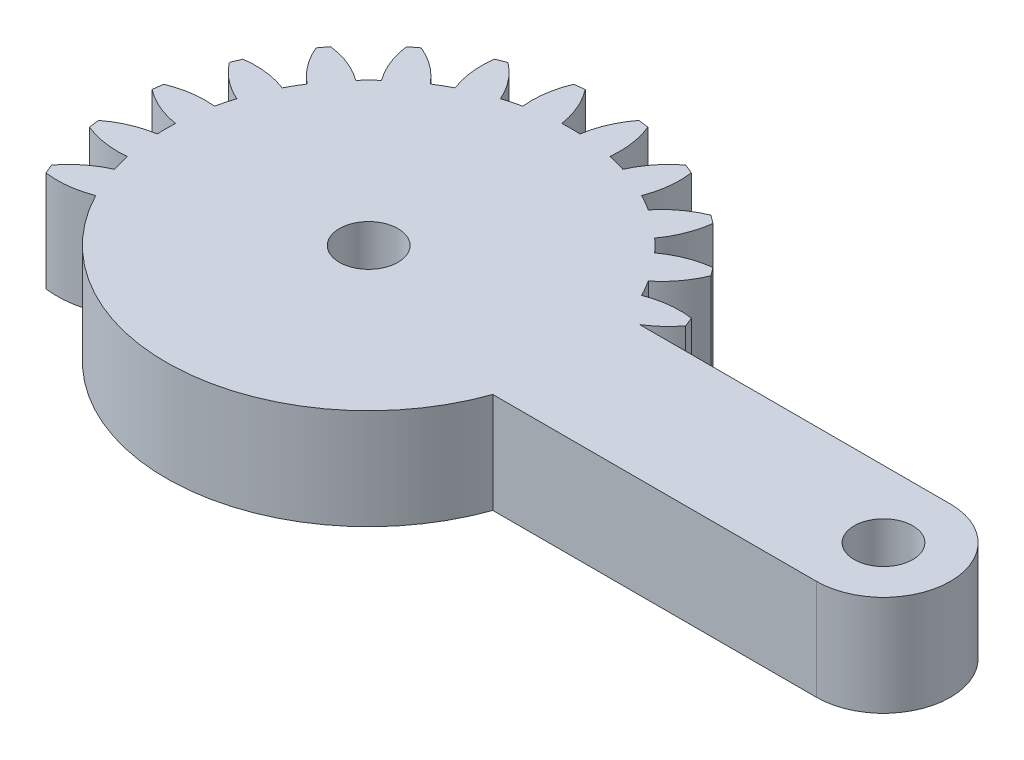
from build123d import *
from build123d.topology import SkipClean

# Parameters (mm, degrees)
SKETCH1_R           = 1.75
BOSS_EXTRUDE1_DEPTH = 4
CUT_EXTRUDE1_START  = -10
CUT_EXTRUDE1_DEPTH  = 10
MOVE_FACE1_BY       = 2


with BuildPart() as part:
    # Sketch1 → Boss-Extrude1 (new body)
    with BuildSketch(Plane(origin=(0, 0, 0), x_dir=(1, 0, 0), z_dir=(0, 1, 0))):
        with BuildLine():
            Line((20.643657446, 4), (2.081641936, 4))
            ThreePointArc((2.081641936, 4), (2.861028333, 4.588201733), (3.521749436, 5.30713988))
            ThreePointArc((3.521749436, 5.30713988), (3.405395609, 5.596745198), (3.282888305, 5.883801663))
            ThreePointArc((3.282888305, 5.883801663), (1.93527598, 5.894040025), (0.627094961, 5.57027124))
            ThreePointArc((0.627094961, 5.57027124), (0.366286148, 6.046375), (0.084372603, 6.510293938))
            ThreePointArc((0.084372603, 6.510293938), (1.018855105, 7.48132754), (1.683794586, 8.65351323))
            ThreePointArc((1.683794586, 8.65351323), (1.496450048, 8.903135899), (1.303821399, 9.148703928))
            ThreePointArc((1.303821399, 9.148703928), (-0.000522033, 8.809805691), (-1.180330337, 8.158486898))
            ThreePointArc((-1.180330337, 8.158486898), (-1.555477026, 8.550865528), (-1.947855656, 8.926012217))
            ThreePointArc((-1.947855656, 8.926012217), (-1.296536862, 10.105820521), (-0.957638625, 11.410163953))
            ThreePointArc((-0.957638625, 11.410163953), (-1.203206655, 11.602792602), (-1.452829324, 11.79013714))
            ThreePointArc((-1.452829324, 11.79013714), (-2.625015014, 11.125197659), (-3.596048616, 10.190715157))
            ThreePointArc((-3.596048616, 10.190715157), (-4.059967554, 10.472628702), (-4.536071314, 10.733437515))
            ThreePointArc((-4.536071314, 10.733437515), (-4.212302529, 12.041618533), (-4.222540891, 13.389230859))
            ThreePointArc((-4.222540891, 13.389230859), (-4.509597355, 13.511738163), (-4.799202674, 13.62809199))
            ThreePointArc((-4.799202674, 13.62809199), (-5.759348103, 12.682425791), (-6.455432668, 11.528463019))
            ThreePointArc((-6.455432668, 11.528463019), (-6.976508546, 11.680699536), (-7.503891752, 11.809396783))
            ThreePointArc((-7.503891752, 11.809396783), (-7.529737283, 13.156800143), (-7.888414517, 14.455843809))
            ThreePointArc((-7.888414517, 14.455843809), (-8.197396993, 14.499881098), (-8.507248835, 14.537314892))
            ThreePointArc((-8.507248835, 14.537314892), (-9.18992168, 13.375367565), (-9.563620196, 12.080565177))
            ThreePointArc((-9.563620196, 12.080565177), (-10.106342554, 12.09275), (-10.649064912, 12.080565177))
            ThreePointArc((-10.649064912, 12.080565177), (-11.022763428, 13.375367565), (-11.705436272, 14.537314892))
            ThreePointArc((-11.705436272, 14.537314892), (-12.015288115, 14.499881098), (-12.324270591, 14.455843809))
            ThreePointArc((-12.324270591, 14.455843809), (-12.682947825, 13.156800143), (-12.708793355, 11.809396783))
            ThreePointArc((-12.708793355, 11.809396783), (-13.236176561, 11.680699536), (-13.757252439, 11.528463019))
            ThreePointArc((-13.757252439, 11.528463019), (-14.453337005, 12.682425791), (-15.413482434, 13.62809199))
            ThreePointArc((-15.413482434, 13.62809199), (-15.703087752, 13.511738163), (-15.990144217, 13.389230859))
            ThreePointArc((-15.990144217, 13.389230859), (-16.000382579, 12.041618533), (-15.676613793, 10.733437515))
            ThreePointArc((-15.676613793, 10.733437515), (-16.152717554, 10.472628702), (-16.616636492, 10.190715157))
            ThreePointArc((-16.616636492, 10.190715157), (-17.587670094, 11.125197659), (-18.759855783, 11.79013714))
            ThreePointArc((-18.759855783, 11.79013714), (-19.009478453, 11.602792602), (-19.255046482, 11.410163953))
            ThreePointArc((-19.255046482, 11.410163953), (-18.916148245, 10.105820521), (-18.264829452, 8.926012217))
            ThreePointArc((-18.264829452, 8.926012217), (-18.657208082, 8.550865528), (-19.032354771, 8.158486898))
            ThreePointArc((-19.032354771, 8.158486898), (-20.212163074, 8.809805691), (-21.516506507, 9.148703928))
            ThreePointArc((-21.516506507, 9.148703928), (-21.709135156, 8.903135899), (-21.896479694, 8.65351323))
            ThreePointArc((-21.896479694, 8.65351323), (-21.231540213, 7.48132754), (-20.297057711, 6.510293938))
            ThreePointArc((-20.297057711, 6.510293938), (-20.578971255, 6.046375), (-20.839780068, 5.57027124))
            ThreePointArc((-20.839780068, 5.57027124), (-22.147961087, 5.894040025), (-23.495573413, 5.883801663))
            ThreePointArc((-23.495573413, 5.883801663), (-23.618080717, 5.596745198), (-23.734434544, 5.30713988))
            ThreePointArc((-23.734434544, 5.30713988), (-22.788768345, 4.346994451), (-21.634805572, 3.650909885))
            ThreePointArc((-21.634805572, 3.650909885), (-21.78704209, 3.129834008), (-21.915739337, 2.602450802))
            ThreePointArc((-21.915739337, 2.602450802), (-23.263142697, 2.576605271), (-24.562186363, 2.217928037))
            ThreePointArc((-24.562186363, 2.217928037), (-24.606223651, 1.908945561), (-24.643657446, 1.599093719))
            ThreePointArc((-24.643657446, 1.599093719), (-23.481710119, 0.916420874), (-22.186907731, 0.542722358))
            ThreePointArc((-22.186907731, 0.542722358), (-22.199092554, 0), (-22.186907731, -0.542722358))
            ThreePointArc((-22.186907731, -0.542722358), (-23.481710119, -0.916420874), (-24.643657446, -1.599093719))
            ThreePointArc((-24.643657446, -1.599093719), (-24.606223651, -1.908945561), (-24.562186363, -2.217928037))
            ThreePointArc((-24.562186363, -2.217928037), (-23.263142697, -2.576605271), (-21.915739337, -2.602450802))
            ThreePointArc((-21.915739337, -2.602450802), (-21.78704209, -3.129834008), (-21.634805572, -3.650909885))
            ThreePointArc((-21.634805572, -3.650909885), (-22.788768345, -4.346994451), (-23.734434544, -5.30713988))
            ThreePointArc((-23.734434544, -5.30713988), (-23.618080717, -5.596745198), (-23.495573413, -5.883801663))
            ThreePointArc((-23.495573413, -5.883801663), (-22.147961087, -5.894040025), (-20.839780068, -5.57027124))
            ThreePointArc((-20.839780068, -5.57027124), (-20.578971255, -6.046375), (-20.297057711, -6.510293938))
            ThreePointArc((-20.297057711, -6.510293938), (-21.231540213, -7.48132754), (-21.896479694, -8.65351323))
            ThreePointArc((-21.896479694, -8.65351323), (-21.709135156, -8.903135899), (-21.516506507, -9.148703928))
            ThreePointArc((-21.516506507, -9.148703928), (-20.212163074, -8.809805691), (-19.032354771, -8.158486898))
            ThreePointArc((-19.032354771, -8.158486898), (-18.657208082, -8.550865528), (-18.264829452, -8.926012217))
            ThreePointArc((-18.264829452, -8.926012217), (-18.916148245, -10.105820521), (-19.255046482, -11.410163953))
            ThreePointArc((-19.255046482, -11.410163953), (-19.009478453, -11.602792602), (-18.759855783, -11.79013714))
            ThreePointArc((-18.759855783, -11.79013714), (-17.587670094, -11.125197659), (-16.616636492, -10.190715157))
            ThreePointArc((-16.616636492, -10.190715157), (-16.152717554, -10.472628702), (-15.676613793, -10.733437515))
            ThreePointArc((-15.676613793, -10.733437515), (-16.000382579, -12.041618533), (-15.990144217, -13.389230859))
            ThreePointArc((-15.990144217, -13.389230859), (-15.703087752, -13.511738163), (-15.413482434, -13.62809199))
            ThreePointArc((-15.413482434, -13.62809199), (-14.453337005, -12.682425791), (-13.757252439, -11.528463019))
            ThreePointArc((-13.757252439, -11.528463019), (-13.236176561, -11.680699536), (-12.708793355, -11.809396783))
            ThreePointArc((-12.708793355, -11.809396783), (-12.682947825, -13.156800143), (-12.324270591, -14.455843809))
            ThreePointArc((-12.324270591, -14.455843809), (-12.015288115, -14.499881098), (-11.705436272, -14.537314892))
            ThreePointArc((-11.705436272, -14.537314892), (-11.022763428, -13.375367565), (-10.649064912, -12.080565177))
            ThreePointArc((-10.649064912, -12.080565177), (-10.106342554, -12.09275), (-9.563620196, -12.080565177))
            ThreePointArc((-9.563620196, -12.080565177), (-9.18992168, -13.375367565), (-8.507248835, -14.537314892))
            ThreePointArc((-8.507248835, -14.537314892), (-8.197396993, -14.499881098), (-7.888414517, -14.455843809))
            ThreePointArc((-7.888414517, -14.455843809), (-7.529737283, -13.156800143), (-7.503891752, -11.809396783))
            ThreePointArc((-7.503891752, -11.809396783), (-6.976508546, -11.680699536), (-6.455432668, -11.528463019))
            ThreePointArc((-6.455432668, -11.528463019), (-5.759348103, -12.682425791), (-4.799202674, -13.62809199))
            ThreePointArc((-4.799202674, -13.62809199), (-4.509597355, -13.511738163), (-4.222540891, -13.389230859))
            ThreePointArc((-4.222540891, -13.389230859), (-4.212302529, -12.041618533), (-4.536071314, -10.733437515))
            ThreePointArc((-4.536071314, -10.733437515), (-4.059967554, -10.472628702), (-3.596048616, -10.190715157))
            ThreePointArc((-3.596048616, -10.190715157), (-2.625015014, -11.125197659), (-1.452829324, -11.79013714))
            ThreePointArc((-1.452829324, -11.79013714), (-1.203206655, -11.602792602), (-0.957638625, -11.410163953))
            ThreePointArc((-0.957638625, -11.410163953), (-1.296536862, -10.105820521), (-1.947855656, -8.926012217))
            ThreePointArc((-1.947855656, -8.926012217), (-1.555477026, -8.550865528), (-1.180330337, -8.158486898))
            ThreePointArc((-1.180330337, -8.158486898), (-0.000522033, -8.809805691), (1.303821399, -9.148703928))
            ThreePointArc((1.303821399, -9.148703928), (1.496450048, -8.903135899), (1.683794586, -8.65351323))
            ThreePointArc((1.683794586, -8.65351323), (1.018855105, -7.48132754), (0.084372603, -6.510293938))
            ThreePointArc((0.084372603, -6.510293938), (0.366286148, -6.046375), (0.627094961, -5.57027124))
            ThreePointArc((0.627094961, -5.57027124), (1.93527598, -5.894040025), (3.282888305, -5.883801663))
            ThreePointArc((3.282888305, -5.883801663), (3.405395609, -5.596745198), (3.521749436, -5.30713988))
            ThreePointArc((3.521749436, -5.30713988), (2.861028333, -4.588201733), (2.081641936, -4))
            Line((2.081641936, -4), (20.643657446, -4))
            ThreePointArc((20.643657446, -4), (24.643657446, 0), (20.643657446, 4))
        make_face()
        with Locations(Location((-10.106342554, 0, 0), (0, 0, 270))):
            Circle(SKETCH1_R, mode=Mode.SUBTRACT)
        with Locations(Location((20.643657446, 0, 0), (0, 0, 270))):
            Circle(SKETCH1_R, mode=Mode.SUBTRACT)
    extrude(amount=BOSS_EXTRUDE1_DEPTH)

    # Sketch2 → Cut-Extrude1 (cut)
    with SkipClean():  # the faces are left unmerged after this step: merging them gives an invalid solid
        with BuildSketch(Plane(origin=(0, 4, 0), x_dir=(1, 0, 0), z_dir=(0, 1, 0)).offset(CUT_EXTRUDE1_START)):
            with BuildLine():
                ThreePointArc((-21.516506507, -9.148703928), (-20.212163074, -8.809805691), (-19.032354771, -8.158486898))
                ThreePointArc((-19.032354771, -8.158486898), (-19.70016616, -7.361599771), (-20.297057711, -6.510293938))
                ThreePointArc((-20.297057711, -6.510293938), (-21.231540213, -7.48132754), (-21.896479694, -8.65351323))
                ThreePointArc((-21.896479694, -8.65351323), (-21.709135156, -8.903135899), (-21.516506507, -9.148703928))
            make_face()
            with BuildLine():
                ThreePointArc((-18.759855783, -11.79013714), (-17.587670094, -11.125197659), (-16.616636492, -10.190715157))
                ThreePointArc((-16.616636492, -10.190715157), (-17.467942324, -9.593823606), (-18.264829452, -8.926012217))
                ThreePointArc((-18.264829452, -8.926012217), (-18.916148245, -10.105820521), (-19.255046482, -11.410163953))
                ThreePointArc((-19.255046482, -11.410163953), (-19.009478453, -11.602792602), (-18.759855783, -11.79013714))
            make_face()
            with BuildLine():
                ThreePointArc((-15.413482434, -13.62809199), (-14.453337005, -12.682425791), (-13.757252439, -11.528463019))
                ThreePointArc((-13.757252439, -11.528463019), (-14.734037631, -11.172244217), (-15.676613793, -10.733437515))
                ThreePointArc((-15.676613793, -10.733437515), (-16.000382579, -12.041618533), (-15.990144217, -13.389230859))
                ThreePointArc((-15.990144217, -13.389230859), (-15.703087752, -13.511738163), (-15.413482434, -13.62809199))
            make_face()
            with BuildLine():
                ThreePointArc((-11.705436272, -14.537314892), (-11.022763428, -13.375367565), (-10.649064912, -12.080565177))
                ThreePointArc((-10.649064912, -12.080565177), (-11.684763165, -11.989294847), (-12.708793355, -11.809396783))
                ThreePointArc((-12.708793355, -11.809396783), (-12.682947825, -13.156800143), (-12.324270591, -14.455843809))
                ThreePointArc((-12.324270591, -14.455843809), (-12.015288115, -14.499881098), (-11.705436272, -14.537314892))
            make_face()
            with BuildLine():
                ThreePointArc((-7.888414517, -14.455843809), (-7.529737283, -13.156800143), (-7.503891752, -11.809396783))
                ThreePointArc((-7.503891752, -11.809396783), (-8.527921943, -11.989294847), (-9.563620196, -12.080565177))
                ThreePointArc((-9.563620196, -12.080565177), (-9.18992168, -13.375367565), (-8.507248835, -14.537314892))
                ThreePointArc((-8.507248835, -14.537314892), (-8.197396993, -14.499881098), (-7.888414517, -14.455843809))
            make_face()
            with BuildLine():
                ThreePointArc((-4.222540891, -13.389230859), (-4.212302529, -12.041618533), (-4.536071314, -10.733437515))
                ThreePointArc((-4.536071314, -10.733437515), (-5.478647477, -11.172244217), (-6.455432668, -11.528463019))
                ThreePointArc((-6.455432668, -11.528463019), (-5.759348103, -12.682425791), (-4.799202674, -13.62809199))
                ThreePointArc((-4.799202674, -13.62809199), (-4.509597355, -13.511738163), (-4.222540891, -13.389230859))
            make_face()
            with BuildLine():
                ThreePointArc((-0.957638625, -11.410163953), (-1.296536862, -10.105820521), (-1.947855656, -8.926012217))
                ThreePointArc((-1.947855656, -8.926012217), (-2.744742783, -9.593823606), (-3.596048616, -10.190715157))
                ThreePointArc((-3.596048616, -10.190715157), (-2.625015014, -11.125197659), (-1.452829324, -11.79013714))
                ThreePointArc((-1.452829324, -11.79013714), (-1.203206655, -11.602792602), (-0.957638625, -11.410163953))
            make_face()
            with BuildLine():
                ThreePointArc((1.683794586, -8.65351323), (1.018855105, -7.48132754), (0.084372603, -6.510293938))
                ThreePointArc((0.084372603, -6.510293938), (-0.512518948, -7.361599771), (-1.180330337, -8.158486898))
                ThreePointArc((-1.180330337, -8.158486898), (-0.000522033, -8.809805691), (1.303821399, -9.148703928))
                ThreePointArc((1.303821399, -9.148703928), (1.496450048, -8.903135899), (1.683794586, -8.65351323))
            make_face()
            with BuildLine():
                ThreePointArc((3.521749436, -5.30713988), (2.861028333, -4.588201733), (2.081641936, -4))
                Line((2.081641936, -4), (1.305695063, -4))
                ThreePointArc((1.305695063, -4), (0.994195953, -4.797149927), (0.627094961, -5.57027124))
                ThreePointArc((0.627094961, -5.57027124), (1.93527598, -5.894040025), (3.282888305, -5.883801663))
                ThreePointArc((3.282888305, -5.883801663), (3.405395609, -5.596745198), (3.521749436, -5.30713988))
            make_face()
        extrude(amount=CUT_EXTRUDE1_DEPTH, mode=Mode.SUBTRACT)

    # Move Face1: a face moved outward by 2.0
    extrude(part.faces().sort_by_distance((-4.746120399, 0, -0.554147216))[0], amount=MOVE_FACE1_BY, dir=(0, -1, 0))


solid = part.part
